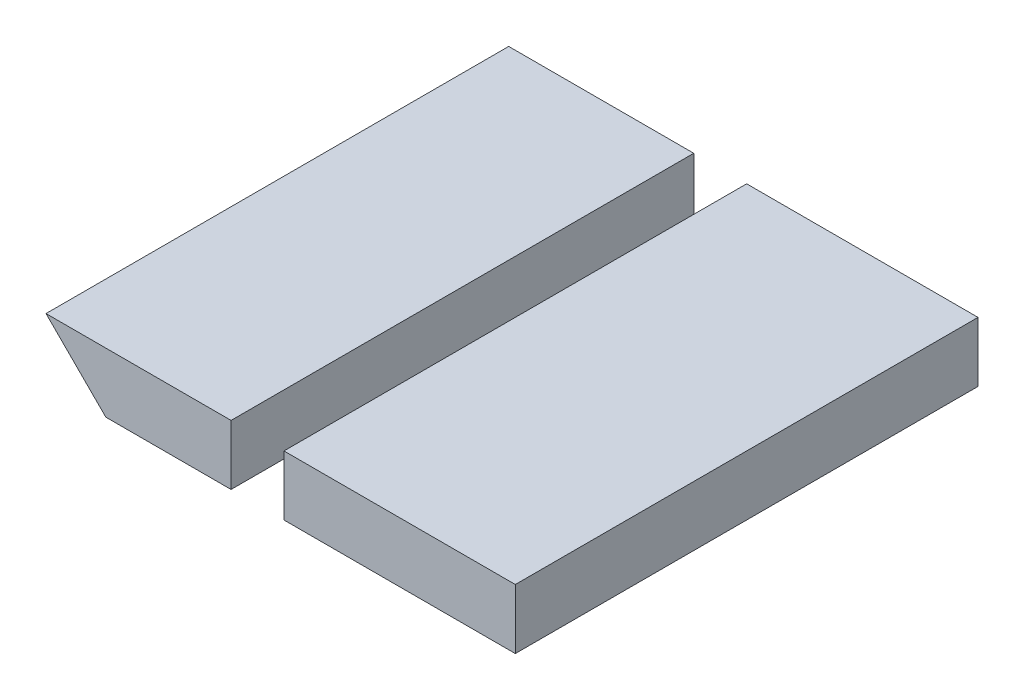
from build123d import *

# Parameters (mm, degrees)
BOSS_EXTRUDE1_DEPTH   = 20
SKETCH1_W             = 10
SKETCH1_H             = 2.5861
BOSS_EXTRUDE1_2_DEPTH = 20


with BuildPart() as part:
    # Sketch1 → Boss-Extrude1 (new body)
    with BuildSketch(Plane.XY):
        Polygon((-7.2861, 15.2861), (-15.2861, 15.2861), (-12.7, 12.7), (-7.2861, 12.7), align=None)
    extrude(amount=BOSS_EXTRUDE1_DEPTH)


with BuildPart() as body_2:
    # Sketch1 → Boss-Extrude1 2 (new body)
    with BuildSketch(Plane.XY):
        with Locations((0, 13.99305)):
            Rectangle(SKETCH1_W, SKETCH1_H)
    extrude(amount=BOSS_EXTRUDE1_2_DEPTH)


solid = Compound([part.part, body_2.part])
